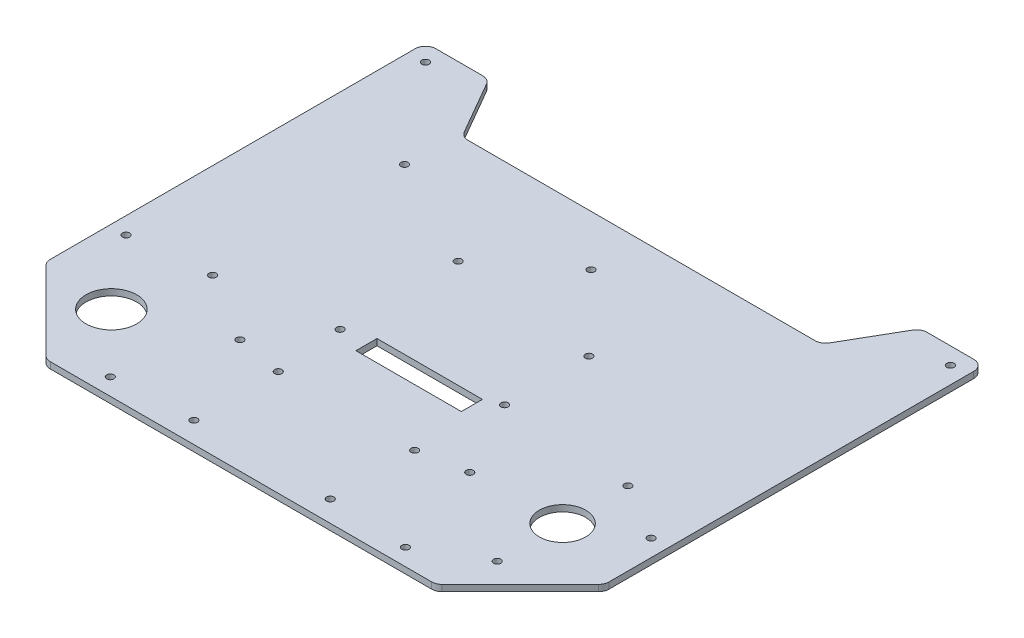
from build123d import *

# Parameters (mm, degrees)
BOSS_EXTRU_1_DEPTH      = 3
CONG_1_R                = 5
ESQUISSE2_R             = 1
ENL_V_MAT_EXTRU_1_DEPTH = 257.837010573
D_GAGEMENT_M31_D        = 3.4
ESQUISSE5_R             = 12
ESQUISSE5_R_2           = 11
ESQUISSE5_R_3           = 1.5
ESQUISSE5_R_4           = 1
ESQUISSE5_W             = 50
ESQUISSE5_H             = 10
ENL_V_MAT_EXTRU_2_DEPTH = 257.837010573
D_GAGEMENT_M32_D        = 3.4
D_GAGEMENT_M32_DEPTH    = 3


with BuildPart() as part:
    # Esquisse1 → Boss.-Extru.1 (new body)
    with BuildSketch(Plane(origin=(0, 0, 0), x_dir=(1, 0, 0), z_dir=(0, 1, 0))):
        Polygon((-92.5, 0), (92.5, 0), (132.5, 40), (132.5, 220), (102.5, 220), (85.179491924, 190), (-85.179491924, 190), (-102.5, 220), (-132.5, 220), (-132.5, 40), align=None)
    extrude(amount=BOSS_EXTRU_1_DEPTH)

    # Congé1
    cong_1_edges = [part.edges().sort_by_distance(p)[0] for p in [
        (92.5, 1.5, 0),
        (-92.5, 1.5, 0),
        (-132.5, 1.5, -40),
        (-132.5, 1.5, -220),
        (-102.5, 1.5, -220),
        (-85.179491924, 1.5, -190),
        (85.179491924, 1.5, -190),
        (102.5, 1.5, -220),
        (132.5, 1.5, -220),
        (132.5, 1.5, -40),
    ]]
    fillet(cong_1_edges, radius=CONG_1_R)

    # Esquisse2 → Enlèv. mat.-Extru.1 (cut, through all)
    with BuildSketch(Plane.XZ):
        with Locations(Location((-70, -8, 0), (0, 0, 270))):
            Circle(ESQUISSE2_R)
        with Locations(Location((-124.5, -70, 0), (0, 0, 270))):
            Circle(ESQUISSE2_R)
        with Locations(Location((-124.5, -212, 0), (0, 0, 270))):
            Circle(ESQUISSE2_R)
        with Locations(Location((124.5, -212, 0), (0, 0, 90))):
            Circle(ESQUISSE2_R)
        with Locations(Location((124.5, -70, 0), (0, 0, 90))):
            Circle(ESQUISSE2_R)
        with Locations(Location((70, -8, 0), (0, 0, 90))):
            Circle(ESQUISSE2_R)
    extrude(amount=-ENL_V_MAT_EXTRU_1_DEPTH, mode=Mode.SUBTRACT)

    # Dégagement M31 (through all)
    with Locations(Plane(origin=(0, 0, 0), x_dir=(-1, 0, 0), z_dir=(0, -1, 0))):
        with Locations((-70, 8), (-124.5, 70), (-124.5, 212), (124.5, 212), (124.5, 70), (70, 8)):
            Hole(D_GAGEMENT_M31_D / 2)

    # Esquisse5 → Enlèv. mat.-Extru.2 (cut, through all)
    with BuildSketch(Plane.XZ):
        with Locations(Location((-97.5, -36, 0), (0, 0, 270))):
            Circle(ESQUISSE5_R)
        with Locations(Location((97.5, -55, 0), (0, 0, 270))):
            Circle(ESQUISSE5_R_2)
        with Locations(Location((97.5, -86, 0), (0, 0, 270))):
            Circle(ESQUISSE5_R_3)
        with Locations(Location((97.5, -24, 0), (0, 0, 270))):
            Circle(ESQUISSE5_R_3)
        with Locations(Location((-35, -138, 0), (0, 0, 270))):
            Circle(ESQUISSE5_R_4)
        with Locations(Location((-35, -82, 0), (0, 0, 270))):
            Circle(ESQUISSE5_R_4)
        with Locations(Location((35, -130, 0), (0, 0, 270))):
            Circle(ESQUISSE5_R_4)
        with Locations(Location((35, -90, 0), (0, 0, 270))):
            Circle(ESQUISSE5_R_4)
        with Locations(Location((0, -166, 0), (0, 0, 270))):
            Circle(ESQUISSE5_R_3)
        with Locations(Location((-54.5, -54, 0), (0, 0, 270))):
            Circle(ESQUISSE5_R_3)
        with Locations(Location((54.5, -54, 0), (0, 0, 270))):
            Circle(ESQUISSE5_R_3)
        with Locations(Location((-87.5, -74, 0), (0, 0, 270))):
            Circle(ESQUISSE5_R_3)
        with Locations(Location((-87.5, -165, 0), (0, 0, 270))):
            Circle(ESQUISSE5_R_3)
        with Locations(Location((-32.335, -50, 0), (0, 0, 270))):
            Circle(ESQUISSE5_R_3)
        with Locations(Location((-32.335, -10, 0), (0, 0, 270))):
            Circle(ESQUISSE5_R_3)
        with Locations(Location((32.335, -10, 0), (0, 0, 270))):
            Circle(ESQUISSE5_R_3)
        with Locations(Location((32.335, -50, 0), (0, 0, 270))):
            Circle(ESQUISSE5_R_3)
        with Locations((2.5, -82)):
            Rectangle(ESQUISSE5_W, ESQUISSE5_H)
    extrude(amount=-ENL_V_MAT_EXTRU_2_DEPTH, mode=Mode.SUBTRACT)

    # Dégagement M32
    with Locations(Plane(origin=(0, 3, 0), x_dir=(1, 0, 0), z_dir=(0, 1, 0))):
        with Locations((97.5, 86), (97.5, 24), (-54.5, 54), (54.5, 54), (0, 166), (-87.5, 74), (-87.5, 165), (-32.335, 50), (-32.335, 10), (32.335, 10), (32.335, 50), (-35, 138), (-35, 82), (35, 90), (35, 130)):
            Hole(D_GAGEMENT_M32_D / 2, depth=D_GAGEMENT_M32_DEPTH)


solid = part.part
